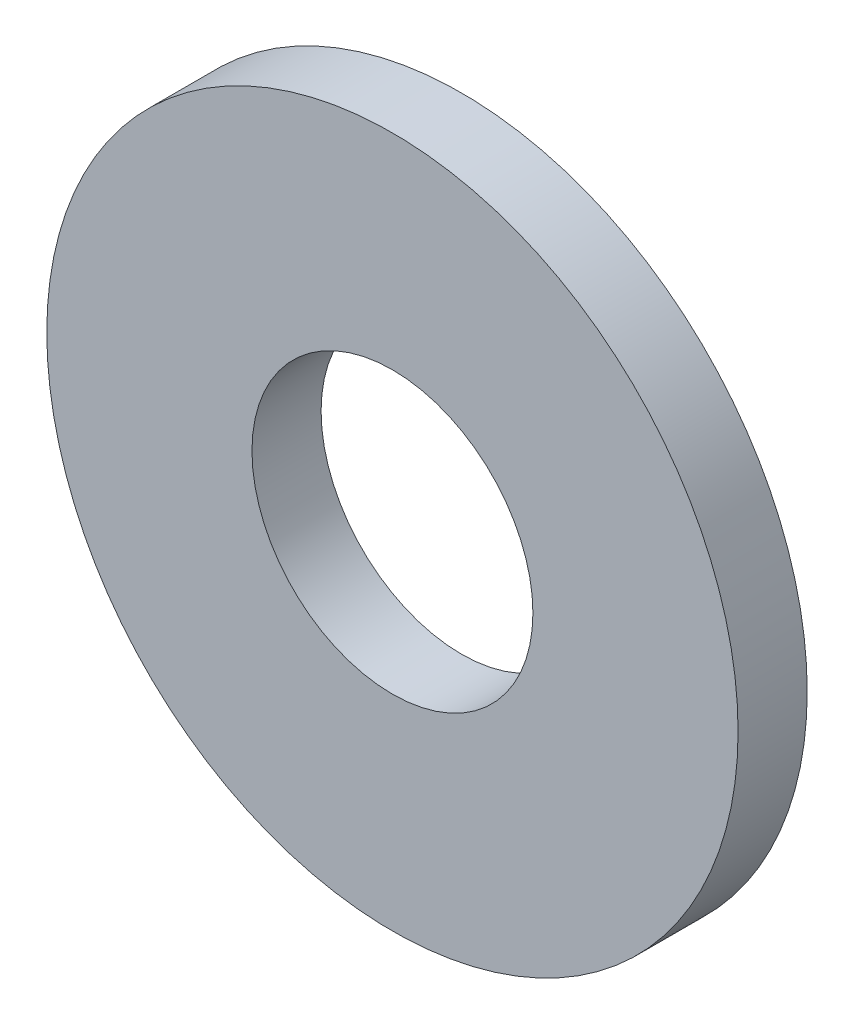
from build123d import *

# Parameters (mm, degrees)
SKETCH1_R      = 7.9375
SKETCH1_R_2    = 3.2258
EXTRUDE1_DEPTH = 0.79375


with BuildPart() as part:
    # Sketch1 → Extrude1 (new, symmetric)
    with BuildSketch(Plane.XY):
        Circle(SKETCH1_R)
        Circle(SKETCH1_R_2, mode=Mode.SUBTRACT)
    extrude(amount=EXTRUDE1_DEPTH, both=True)


solid = part.part
